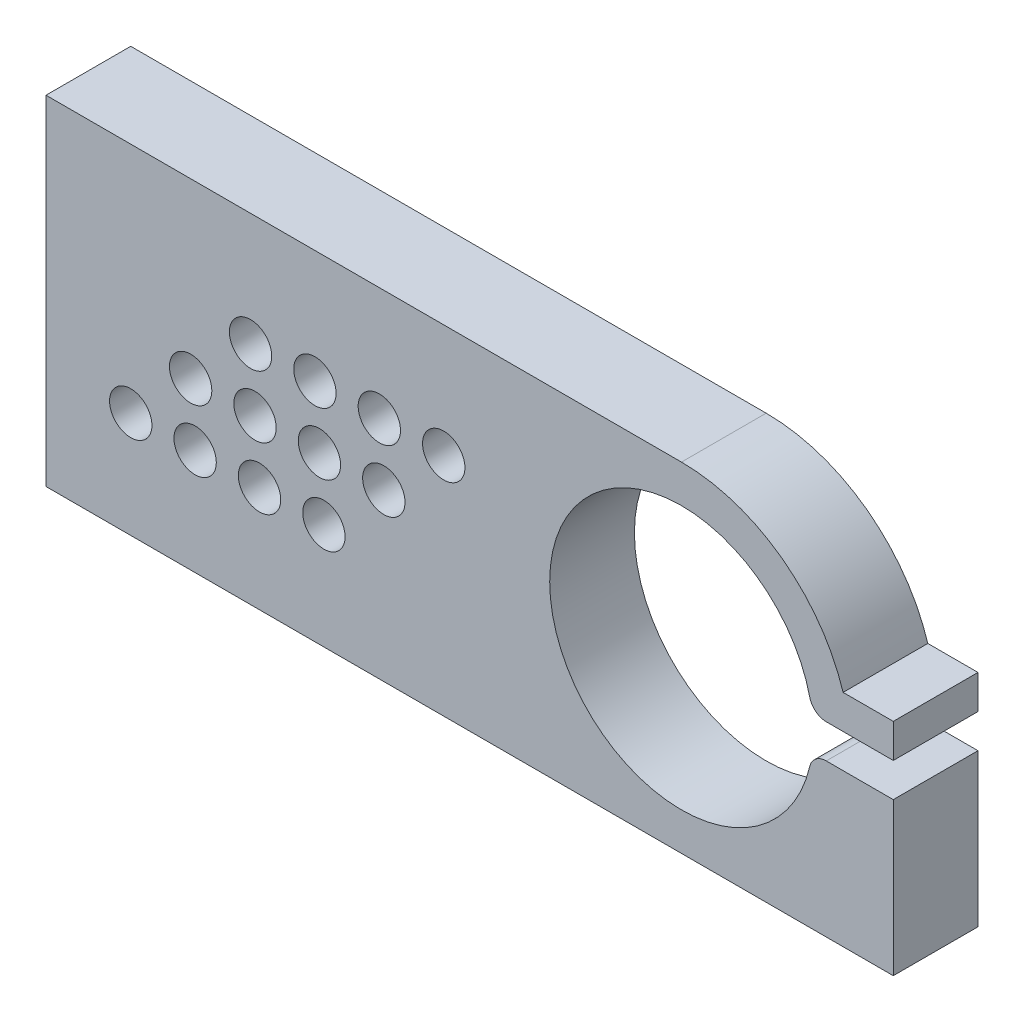
from build123d import *

# Parameters (mm, degrees)
BOSS_EXTRUDE1_DEPTH = 12.7
FILLET2_R           = 2.54
SKETCH2_R           = 3.175
CUT_EXTRUDE1_DEPTH  = 12.7


with BuildPart() as part:
    # Sketch1 → Boss-Extrude1 (new body)
    with BuildSketch(Plane.XY):
        with BuildLine():
            ThreePointArc((31.750000111, -25.4), (6.35, -1.11e-07), (31.749999889, 25.4))
            Line((31.749999889, 25.4), (-63.5, 25.4))
            Line((-63.5, 25.4), (-63.5, -25.4))
            Line((-63.5, -25.4), (31.750000111, -25.4))
        make_face()
        with BuildLine():
            ThreePointArc((49.97081502, -7.62), (12, 0), (49.97081502, 7.62))
            Line((49.97081502, 7.62), (55.980055716, 7.62))
            ThreePointArc((55.980055716, 7.62), (46.776842604, 20.478134714), (31.749999889, 25.4))
            ThreePointArc((31.749999889, 25.4), (6.35, -1.11e-07), (31.750000111, -25.4))
            ThreePointArc((31.750000111, -25.4), (46.776842694, -20.478134648), (55.980055716, -7.62))
            Line((55.980055716, -7.62), (49.97081502, -7.62))
        make_face()
        with BuildLine():
            ThreePointArc((49.97081502, 7.62), (50.823284356, 5.125653506), (51.335987338, 2.54))
            Line((51.335987338, 2.54), (57.022680903, 2.54))
            ThreePointArc((57.022680903, 2.54), (56.631355132, 5.106678649), (55.980055716, 7.62))
            Line((55.980055716, 7.62), (49.97081502, 7.62))
        make_face()
        with BuildLine():
            ThreePointArc((55.980055716, 7.62), (56.631355132, 5.106678649), (57.022680903, 2.54))
            Line((57.022680903, 2.54), (63.5, 2.54))
            Line((63.5, 2.54), (63.5, 7.62))
            Line((63.5, 7.62), (55.980055716, 7.62))
        make_face()
        with BuildLine():
            Line((57.022680903, -2.54), (51.335987338, -2.54))
            ThreePointArc((51.335987338, -2.54), (50.823284356, -5.125653506), (49.97081502, -7.62))
            Line((49.97081502, -7.62), (55.980055716, -7.62))
            ThreePointArc((55.980055716, -7.62), (56.631355132, -5.106678649), (57.022680903, -2.54))
        make_face()
        with BuildLine():
            Line((63.5, -2.54), (57.022680903, -2.54))
            ThreePointArc((57.022680903, -2.54), (56.631355132, -5.106678649), (55.980055716, -7.62))
            Line((55.980055716, -7.62), (63.5, -7.62))
            Line((63.5, -7.62), (63.5, -2.54))
        make_face()
        with BuildLine():
            Line((63.5, -7.62), (55.980055716, -7.62))
            ThreePointArc((55.980055716, -7.62), (46.776842694, -20.478134648), (31.750000111, -25.4))
            Line((31.750000111, -25.4), (63.5, -25.4))
            Line((63.5, -25.4), (63.5, -7.62))
        make_face()
    extrude(amount=BOSS_EXTRUDE1_DEPTH)

    # Fillet2
    fillet2_edges = [part.edges().sort_by_distance(p)[0] for p in [
        (51.335987338, 2.54, 6.35),
        (51.335987338, -2.54, 6.35),
    ]]
    fillet(fillet2_edges, radius=FILLET2_R)

    # Sketch2 → Cut-Extrude1 (cut)
    with BuildSketch(Plane.XY.offset(12.7)):
        with Locations((-50.8, -9.525)):
            Circle(SKETCH2_R)
        with Locations((-41.819743879, -0.544743879)):
            Circle(SKETCH2_R)
        with Locations((-32.839487758, 8.435512242)):
            Circle(SKETCH2_R)
        with Locations((-41.148, -9.525)):
            Circle(SKETCH2_R)
        with Locations((-32.167743879, -0.544743879)):
            Circle(SKETCH2_R)
        with Locations((-23.187487758, 8.435512242)):
            Circle(SKETCH2_R)
        with Locations((-31.496, -9.525)):
            Circle(SKETCH2_R)
        with Locations((-22.515743879, -0.544743879)):
            Circle(SKETCH2_R)
        with Locations((-13.535487758, 8.435512242)):
            Circle(SKETCH2_R)
        with Locations((-21.844, -9.525)):
            Circle(SKETCH2_R)
        with Locations((-12.863743879, -0.544743879)):
            Circle(SKETCH2_R)
        with Locations((-3.883487758, 8.435512242)):
            Circle(SKETCH2_R)
    extrude(amount=-CUT_EXTRUDE1_DEPTH, mode=Mode.SUBTRACT)


solid = part.part
